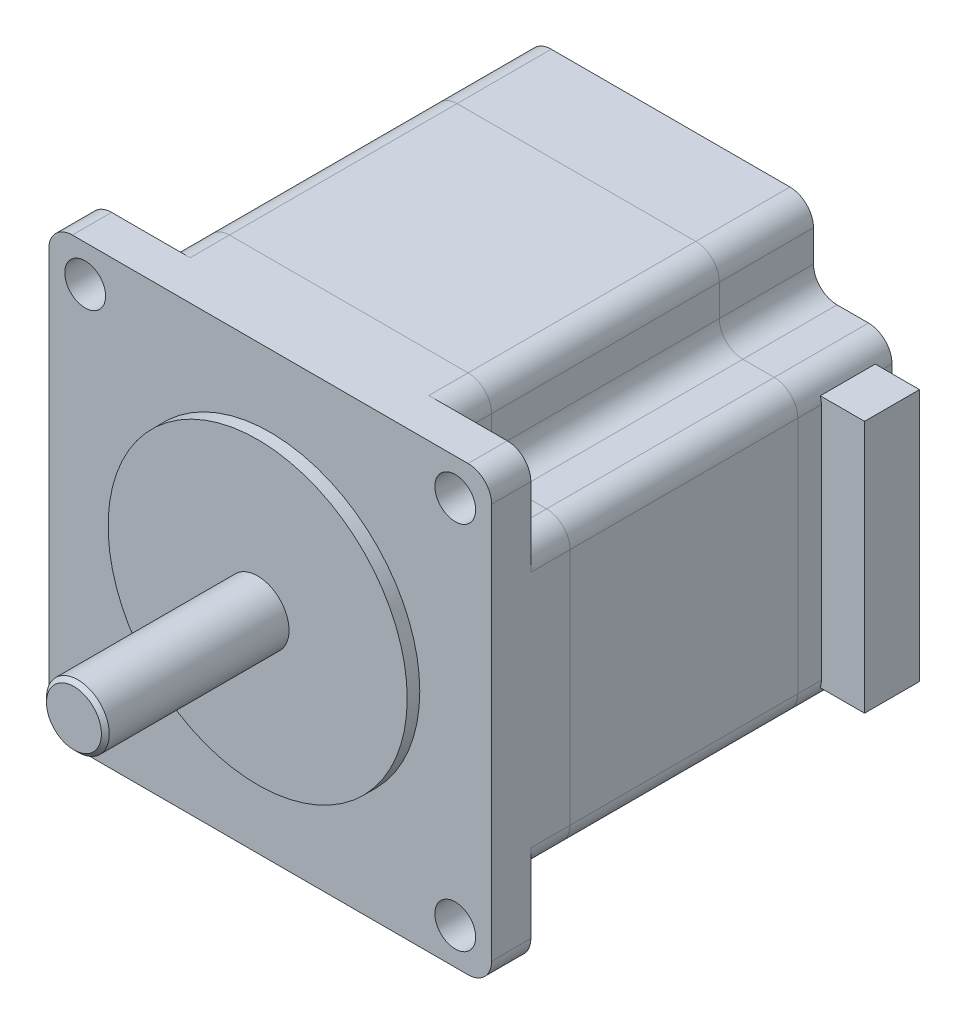
from build123d import *

# Parameters (mm, degrees)
SKETCH1_W                = 56.4
SKETCH1_H                = 56.4
BOSS_EXTRUDE1_DEPTH      = 5
SKETCH2_R                = 19.05
BOSS_EXTRUDE2_DEPTH      = 1.6
SKETCH3_R                = 4
SHALF_DEPTH              = 23.4
CHAMFER1_SIZE            = 0.5
CUT_EXTRUDE1_DEPTH       = 48.068885689
CUT_EXTRUDE1_DEPTH_BACK  = 48.068885689
SKETCH4_R                = 2.6
FILLET1_R                = 3
BOSS_EXTRUDE4_DEPTH      = 46
FILLET2_R                = 3
BOSS_EXTRUDE5_DEPTH      = 5.5
BOSS_EXTRUDE5_DEPTH_BACK = 5
SKETCH6_W                = 7
SKETCH6_H                = 32.2


with BuildPart() as part:
    # Sketch1 → Boss-Extrude1 (new body)
    with BuildSketch(Plane.XY):
        Rectangle(SKETCH1_W, SKETCH1_H)
    extrude(amount=-BOSS_EXTRUDE1_DEPTH)

    # Sketch2 → Boss-Extrude2 (add)
    with BuildSketch(Plane.XY):
        Circle(SKETCH2_R)
    extrude(amount=BOSS_EXTRUDE2_DEPTH)

    # Sketch3 → Shalf (add)
    with BuildSketch(Plane.XY.offset(1.6)):
        Circle(SKETCH3_R)
    extrude(amount=SHALF_DEPTH)

    # Chamfer1
    chamfer1_edges = [part.edges().sort_by_distance(p)[0] for p in [
        (-4, 0, 25),
    ]]
    chamfer(chamfer1_edges, length=CHAMFER1_SIZE)

    # Sketch4 → Cut-Extrude1 (cut, two sides: drawn at the far end of the back side and taken through both)
    with BuildSketch(Plane.XY.offset(-CUT_EXTRUDE1_DEPTH_BACK)):
        with Locations((-23.57, 23.57)):
            Circle(SKETCH4_R)
        with Locations((23.57, 23.57)):
            Circle(SKETCH4_R)
        with Locations((-23.57, -23.57)):
            Circle(SKETCH4_R)
        with Locations((23.57, -23.57)):
            Circle(SKETCH4_R)
    extrude(amount=CUT_EXTRUDE1_DEPTH + CUT_EXTRUDE1_DEPTH_BACK, mode=Mode.SUBTRACT)

    # Fillet1
    fillet1_edges = [part.edges().sort_by_distance(p)[0] for p in [
        (28.2, -28.2, -2.5),
        (-28.2, -28.2, -2.5),
        (-28.2, 28.2, -2.5),
        (28.2, 28.2, -2.5),
    ]]
    fillet(fillet1_edges, radius=FILLET1_R)

    # Sketch5 → Boss-Extrude4 (add)
    with BuildSketch(Plane(origin=(0, 0, -5), x_dir=(-1, 0, 0), z_dir=(0, 0, -1))):
        Polygon((-18.2, 28.2), (18.2, 28.2), (18.2, 18.2), (28.2, 18.2), (28.2, -18.2), (18.2, -18.2), (18.2, -28.2), (-18.2, -28.2), (-18.2, -18.2), (-28.2, -18.2), (-28.2, 18.2), (-18.2, 18.2), align=None)
    extrude(amount=BOSS_EXTRUDE4_DEPTH)

    # Fillet2
    fillet2_edges = [part.edges().sort_by_distance(p)[0] for p in [
        (28.2, -18.2, -28),
        (18.2, -18.2, -28),
        (18.2, -28.2, -28),
        (-18.2, -28.2, -28),
        (-28.2, -18.2, -28),
        (-28.2, 18.2, -28),
        (-18.2, 28.2, -28),
        (28.2, 18.2, -28),
        (18.2, 28.2, -28),
        (-18.2, -18.2, -28),
        (-18.2, 18.2, -28),
        (18.2, 18.2, -28),
    ]]
    fillet(fillet2_edges, radius=FILLET2_R)

    # Sketch6 → Boss-Extrude5 (add, two sides: drawn at the far end of the back side and taken through both)
    with BuildSketch(Plane(origin=(28.2, 0, 0), x_dir=(0, 0, -1), z_dir=(1, 0, 0)).offset(-BOSS_EXTRUDE5_DEPTH_BACK)):
        with Locations((45.5, 0)):
            Rectangle(SKETCH6_W, SKETCH6_H)
    extrude(amount=BOSS_EXTRUDE5_DEPTH + BOSS_EXTRUDE5_DEPTH_BACK)


solid = part.part
